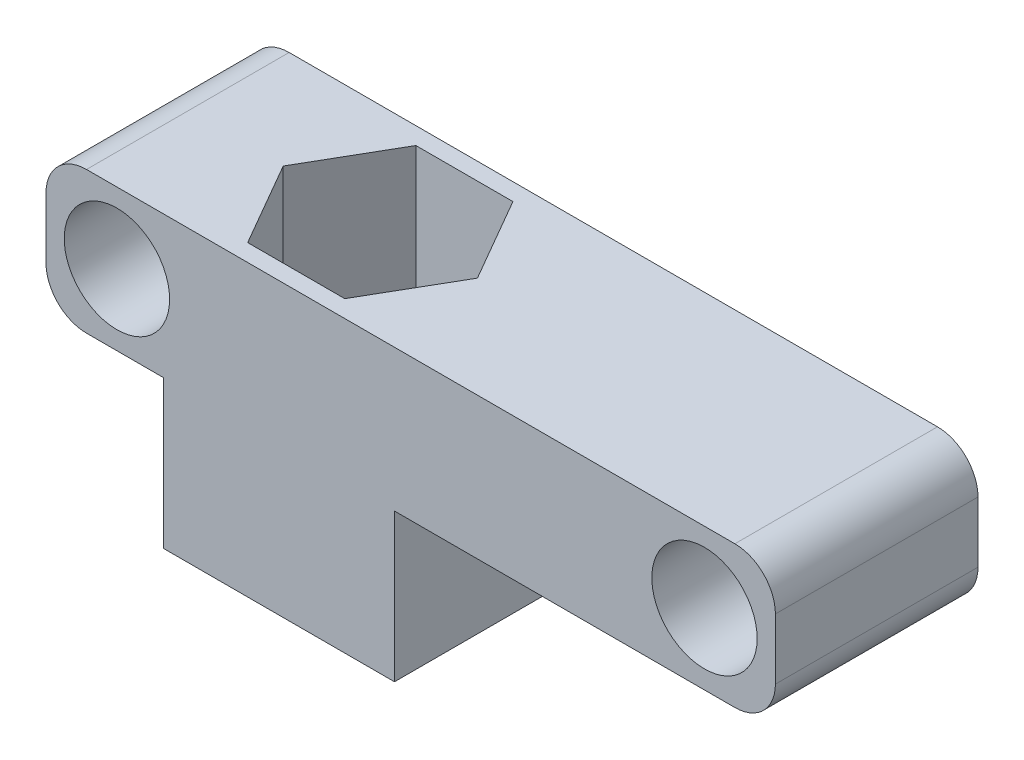
from build123d import *

# Parameters (mm, degrees)
CROQUIS1_W              = 36
CROQUIS1_H              = 7
CROQUIS1_R              = 2.6
SALIENTE_EXTRUIR1_DEPTH = 10
CORTAR_EXTRUIR1_DEPTH   = 7
CROQUIS4_W              = 11.4
CROQUIS4_H              = 10
SALIENTE_EXTRUIR2_DEPTH = 5
REDONDEO1_R             = 2
CROQUIS5_W              = 11.4
CROQUIS5_H              = 10
CROQUIS5_R              = 3.25
SALIENTE_EXTRUIR3_DEPTH = 2.3


with BuildPart() as part:
    # Croquis1 → Saliente-Extruir1 (new body)
    with BuildSketch(Plane.XY):
        with Locations((-28.016694491, 12.37804878)):
            Rectangle(CROQUIS1_W, CROQUIS1_H)
        with Locations((-42.516694491, 12.37804878)):
            Circle(CROQUIS1_R, mode=Mode.SUBTRACT)
        with Locations((-13.516694491, 12.37804878)):
            Circle(CROQUIS1_R, mode=Mode.SUBTRACT)
    extrude(amount=SALIENTE_EXTRUIR1_DEPTH)

    # Croquis2 → Cortar-Extruir1 (cut)
    with BuildSketch(Plane.XZ.offset(-8.87804878)):
        Polygon((-29.724687257, 5), (-32.120690874, 9.15), (-36.912698108, 9.15), (-39.308701725, 5), (-36.912698108, 0.85), (-32.120690874, 0.85), align=None)
    extrude(amount=-CORTAR_EXTRUIR1_DEPTH, mode=Mode.SUBTRACT)

    # Croquis4 → Saliente-Extruir2 (add)
    with BuildSketch(Plane.XZ.offset(-8.87804878)):
        with Locations((-34.516694491, 5)):
            Rectangle(CROQUIS4_W, CROQUIS4_H)
        Polygon((-29.816694491, 5), (-32.166694491, 9.070319398), (-36.866694491, 9.070319398), (-39.216694491, 5), (-36.866694491, 0.929680602), (-32.166694491, 0.929680602), align=None, mode=Mode.SUBTRACT)
    extrude(amount=SALIENTE_EXTRUIR2_DEPTH)

    # Redondeo1
    redondeo1_edges = [part.edges().sort_by_distance(p)[0] for p in [
        (-10.016694491, 15.87804878, 5),
        (-10.016694491, 8.87804878, 5),
        (-46.016694491, 8.87804878, 5),
        (-46.016694491, 15.87804878, 5),
    ]]
    fillet(redondeo1_edges, radius=REDONDEO1_R)

    # Croquis5 → Saliente-Extruir3 (add)
    with BuildSketch(Plane.XZ.offset(-3.87804878)):
        with Locations((-34.516694491, 5)):
            Rectangle(CROQUIS5_W, CROQUIS5_H)
        with Locations(Location((-34.516694491, 5, 0), (0, 0, 270))):
            Circle(CROQUIS5_R, mode=Mode.SUBTRACT)
    extrude(amount=SALIENTE_EXTRUIR3_DEPTH)


solid = part.part
